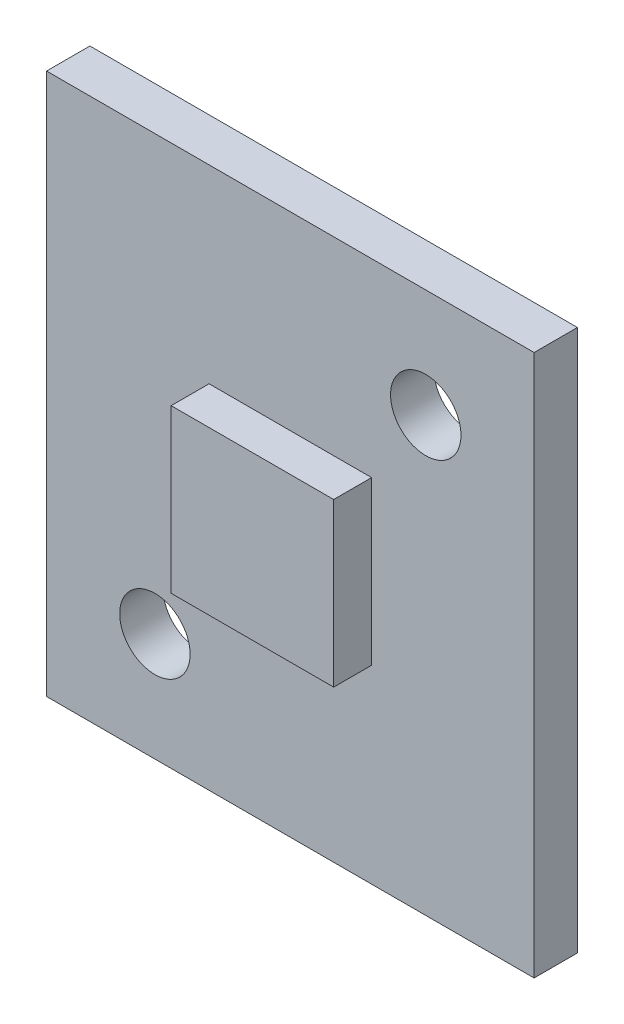
from build123d import *

# Parameters (mm, degrees)
V10_IMU_CANDIDATE18X20_START           = 38
SKETCH_2_W                             = 18
SKETCH_2_H                             = 20
V10_IMU_CANDIDATE18X20_DEPTH           = 1.6
V10_IMU_PACKAGE_START                  = 39.6
SKETCH_3_W                             = 6
SKETCH_3_H                             = 6
V10_IMU_PACKAGE_DEPTH                  = 1.4
SKETCH_4_R                             = 1.3
V10_IMU_DIAGONAL_CANDIDATE_HOLES_DEPTH = 1.6


with BuildPart() as part:
    # 草图2 → V10_IMU_candidate18x20 (new body)
    with BuildSketch(Plane.XY.offset(V10_IMU_CANDIDATE18X20_START)):
        with Locations((-65, -60)):
            Rectangle(SKETCH_2_W, SKETCH_2_H)
    extrude(amount=V10_IMU_CANDIDATE18X20_DEPTH)

    # 草图3 → V10_IMU_package (add)
    with BuildSketch(Plane.XY.offset(V10_IMU_PACKAGE_START)):
        with Locations((-65, -60)):
            Rectangle(SKETCH_3_W, SKETCH_3_H)
    extrude(amount=V10_IMU_PACKAGE_DEPTH)

    # 草图4 → V10_IMU_diagonal_candidate_holes (cut)
    with BuildSketch(Plane.XY.offset(39.6)):
        with Locations((-70, -66)):
            Circle(SKETCH_4_R)
        with Locations((-60, -54)):
            Circle(SKETCH_4_R)
    extrude(amount=-V10_IMU_DIAGONAL_CANDIDATE_HOLES_DEPTH, mode=Mode.SUBTRACT)


solid = part.part
